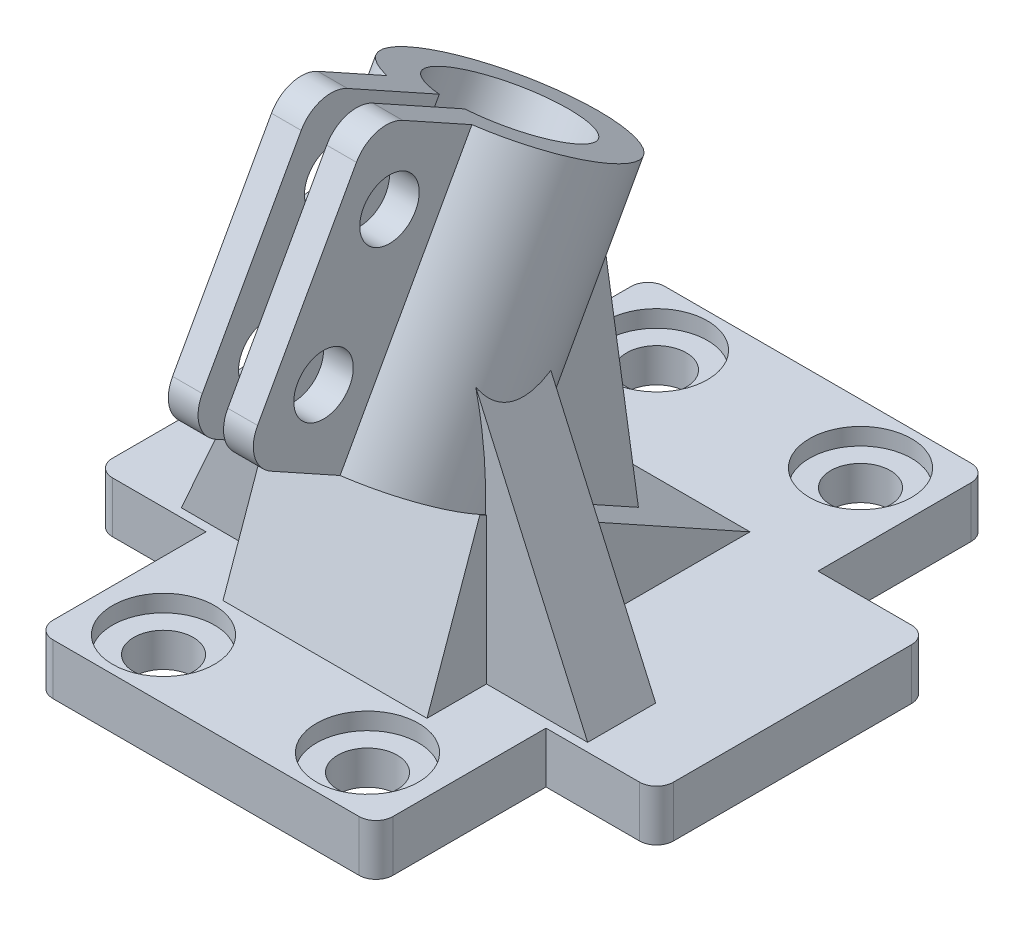
from build123d import *

# Parameters (mm, degrees)
SKETCH_1_W          = 20
SKETCH_1_H          = 36
EXTRUDE_1_DEPTH     = 3
SKETCH_2_W          = 33
SKETCH_2_H          = 16
EXTRUDE_2_DEPTH     = 3
EXTRUDE_4_DEPTH     = 6
EXTRUDE_6_DEPTH     = 16
EXTRUDE_7_DEPTH     = 4
SKETCH_13_R         = 1.75
CUT_EXTRUDE_4_DEPTH = 42.261436472
FILLET_3_R          = 2
FILLET_5_R          = 1
SKETCH_14_R         = 1.75
CUT_EXTRUDE_5_DEPTH = 38.098338449
SKETCH_15_R         = 3
CUT_EXTRUDE_6_DEPTH = 1
EXTRUDE_8_DEPTH     = 2


with BuildPart() as part:
    # 草图1 → 凸台-拉伸1 (new body)
    with BuildSketch(Plane(origin=(0, 0, 0), x_dir=(1, 0, 0), z_dir=(0, 1, 0))):
        Rectangle(SKETCH_1_W, SKETCH_1_H)
    extrude(amount=EXTRUDE_1_DEPTH)

    # 草图2 → 凸台-拉伸2 (add)
    with BuildSketch(Plane(origin=(0, 3, 0), x_dir=(1, 0, 0), z_dir=(0, 1, 0))):
        Rectangle(SKETCH_2_W, SKETCH_2_H)
    extrude(amount=-EXTRUDE_2_DEPTH)

    # 草图9 → 凸台-拉伸4 (add, symmetric)
    with BuildSketch(Plane(origin=(0, 0, 0), x_dir=(0, 0, -1), z_dir=(1, 0, 0))):
        Polygon((-11, 3), (-7.89033458, 11.808156288), (8, 3), align=None)
    extrude(amount=EXTRUDE_4_DEPTH, both=True)

    # 草图11 → 凸台-拉伸6 (add)
    with BuildSketch(Plane(origin=(0, 5.687071281, -3.152395087), x_dir=(1, 0, 0), z_dir=(0, 0.8746197071393988, -0.48480962024633173))):
        with BuildLine():
            Line((0.75, -24.683935623), (2.5, -24.683935623))
            Line((2.5, -24.683935623), (2.5, -18.025055397))
            ThreePointArc((2.5, -18.025055397), (0, -6.675749886), (-2.5, -18.025055397))
            Line((-2.5, -18.025055397), (-2.5, -24.683935623))
            Line((-2.5, -24.683935623), (-0.75, -24.683935623))
            Line((-0.75, -24.683935623), (-0.75, -16.503893772))
            ThreePointArc((-0.75, -16.503893772), (0, -8.675749886), (0.75, -16.503893772))
            Line((0.75, -16.503893772), (0.75, -24.683935623))
        make_face()
    extrude(amount=EXTRUDE_6_DEPTH)

    # 草图12 → 凸台-拉伸7 (add, symmetric)
    with BuildSketch(Plane(origin=(0, 0, 0), x_dir=(0, 0, -1), z_dir=(1, 0, 0))):
        Polygon((-4.435586737, 9.893158289), (1.382128706, 20.388594774), (3.435990627, 5.529871706), align=None)
    extrude(amount=EXTRUDE_7_DEPTH, both=True)

    # 草图13 → 切除-拉伸4 (cut, through all)
    with BuildSketch(Plane(origin=(2.5, 0, 0), x_dir=(0, 0, -1), z_dir=(1, 0, 0))):
        with Locations(Location((-9.706952079, 26.535372625, 0), (0, 0, 180))):
            Circle(SKETCH_13_R)
        with Locations(Location((-13.585429041, 19.538414968, 0), (0, 0, 180))):
            Circle(SKETCH_13_R)
    extrude(amount=-CUT_EXTRUDE_4_DEPTH, mode=Mode.SUBTRACT)

    # 圆角3
    fillet_3_edges = [part.edges().sort_by_distance(p)[0] for p in [
        (-1.625, 17.654080736, 18.436661458),
        (1.625, 17.654080736, 18.436661458),
        (-1.625, 31.647996051, 10.679707534),
        (1.625, 31.647996051, 10.679707534),
    ]]
    fillet(fillet_3_edges, radius=FILLET_3_R)

    # 圆角5
    fillet_5_edges = [part.edges().sort_by_distance(p)[0] for p in [
        (16.5, 1.5, 8),
        (-16.5, 1.5, -8),
        (16.5, 1.5, -8),
        (-16.5, 1.5, 8),
        (10, 1.5, 18),
        (-10, 1.5, 18),
        (-10, 1.5, -18),
        (10, 1.5, -18),
    ]]
    fillet(fillet_5_edges, radius=FILLET_5_R)

    # 草图14 → 切除-拉伸5 (cut, through all)
    with BuildSketch(Plane(origin=(0, 3, 0), x_dir=(1, 0, 0), z_dir=(0, 1, 0))):
        with Locations(Location((-6, -14.5, 0), (0, 0, 270))):
            Circle(SKETCH_14_R)
        with Locations(Location((-6, 14.5, 0), (0, 0, 270))):
            Circle(SKETCH_14_R)
        with Locations(Location((6, 14.5, 0), (0, 0, 270))):
            Circle(SKETCH_14_R)
        with Locations(Location((6, -14.5, 0), (0, 0, 270))):
            Circle(SKETCH_14_R)
    extrude(amount=-CUT_EXTRUDE_5_DEPTH, mode=Mode.SUBTRACT)

    # 草图15 → 切除-拉伸6 (cut)
    with BuildSketch(Plane(origin=(0, 3, 0), x_dir=(1, 0, 0), z_dir=(0, 1, 0))):
        with Locations(Location((6, -14.5, 0), (0, 0, 270))):
            Circle(SKETCH_15_R)
        with Locations(Location((-6, -14.5, 0), (0, 0, 270))):
            Circle(SKETCH_15_R)
        with Locations(Location((6, 14.5, 0), (0, 0, 270))):
            Circle(SKETCH_15_R)
        with Locations(Location((-6, 14.5, 0), (0, 0, 270))):
            Circle(SKETCH_15_R)
    extrude(amount=-CUT_EXTRUDE_6_DEPTH, mode=Mode.SUBTRACT)

    # 草图16 → 凸台-拉伸8 (add, symmetric)
    with BuildSketch(Plane(origin=(0, 0, 5.5), x_dir=(-1, 0, 0), z_dir=(0, 0, -1))):
        Polygon((-3.95, 21), (-11.95, 3), (-3.95, 3), align=None)
        Polygon((3.95, 3), (3.95, 21), (11.95, 3), align=None)
    extrude(amount=EXTRUDE_8_DEPTH, both=True)


solid = part.part
